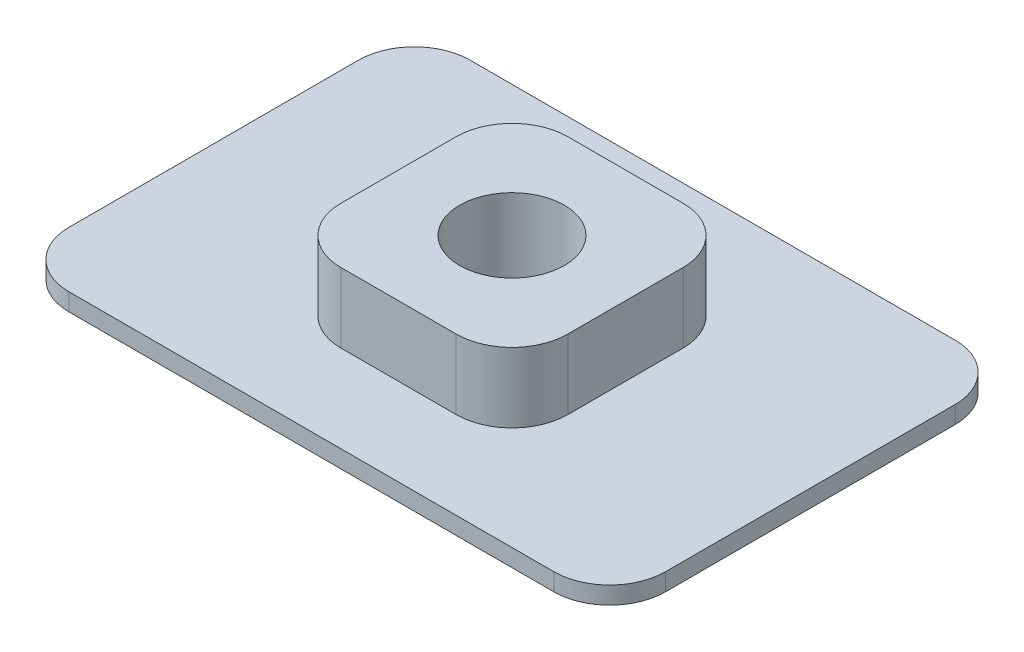
from build123d import *

# Parameters (mm, degrees)
CROQUIS1_W              = 85.5
CROQUIS1_H              = 57.5
SALIENTE_EXTRUIR1_DEPTH = 2.5
REDONDEO1_R             = 8
CROQUIS2_W              = 32.5
CROQUIS2_H              = 32.5
SALIENTE_EXTRUIR2_DEPTH = 10
REDONDEO2_R             = 8
CROQUIS3_R              = 7.5
CORTAR_EXTRUIR1_DEPTH   = 54.012970111


with BuildPart() as part:
    # Croquis1 → Saliente-Extruir1 (new body)
    with BuildSketch(Plane(origin=(0, 0, 0), x_dir=(1, 0, 0), z_dir=(0, 1, 0))):
        Rectangle(CROQUIS1_W, CROQUIS1_H)
    extrude(amount=SALIENTE_EXTRUIR1_DEPTH)

    # Redondeo1
    redondeo1_edges = [part.edges().sort_by_distance(p)[0] for p in [
        (42.75, 1.25, 28.75),
        (-42.75, 1.25, 28.75),
        (-42.75, 1.25, -28.75),
        (42.75, 1.25, -28.75),
    ]]
    fillet(redondeo1_edges, radius=REDONDEO1_R)

    # Croquis2 → Saliente-Extruir2 (add)
    with BuildSketch(Plane(origin=(0, 2.5, 0), x_dir=(1, 0, 0), z_dir=(0, 1, 0))):
        Rectangle(CROQUIS2_W, CROQUIS2_H)
    extrude(amount=SALIENTE_EXTRUIR2_DEPTH)

    # Redondeo2
    redondeo2_edges = [part.edges().sort_by_distance(p)[0] for p in [
        (16.25, 7.5, 16.25),
        (16.25, 7.5, -16.25),
        (-16.25, 7.5, -16.25),
        (-16.25, 7.5, 16.25),
    ]]
    fillet(redondeo2_edges, radius=REDONDEO2_R)

    # Croquis3 → Cortar-Extruir1 (cut, through all)
    with BuildSketch(Plane(origin=(0, 12.5, 0), x_dir=(1, 0, 0), z_dir=(0, 1, 0))):
        with Locations(Location((0, 0, 0), (0, 0, 270))):
            Circle(CROQUIS3_R)
    extrude(amount=-CORTAR_EXTRUIR1_DEPTH, mode=Mode.SUBTRACT)


solid = part.part
